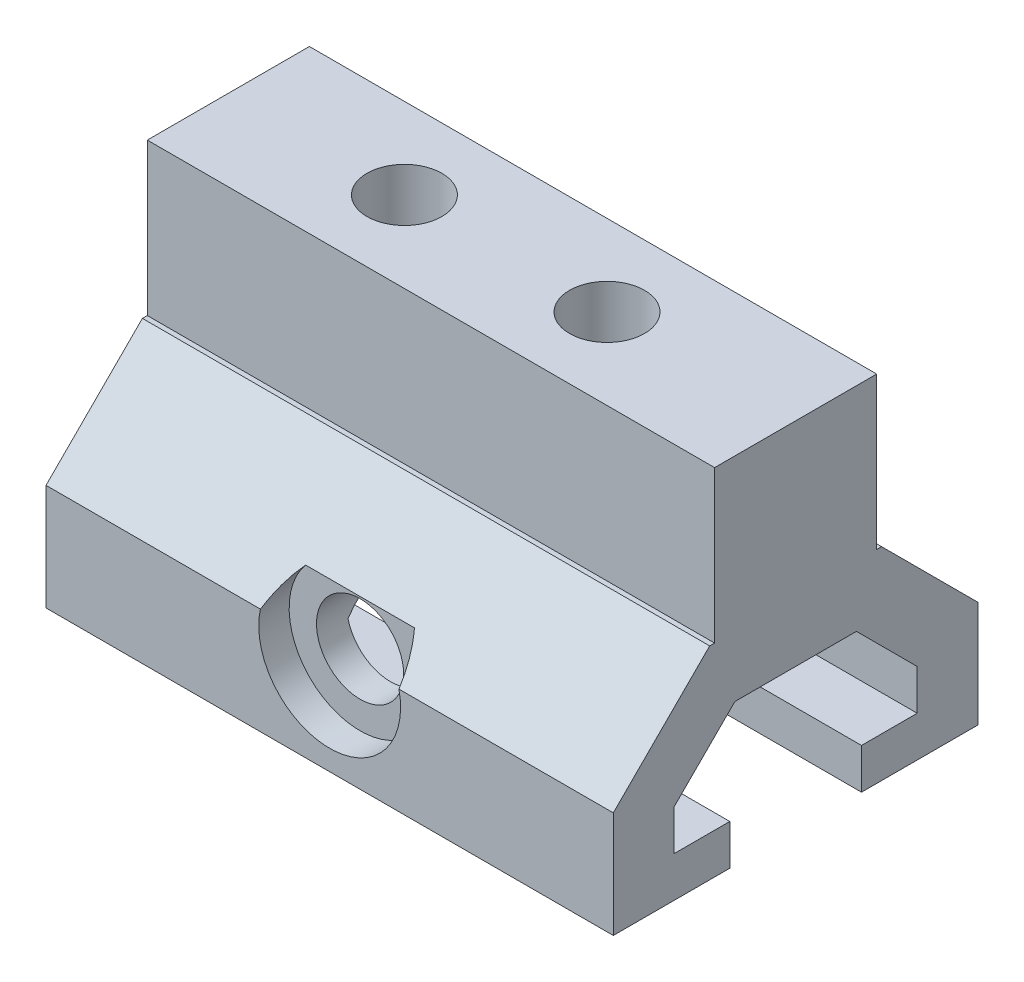
from build123d import *
from build123d.topology import SkipClean

# Parameters (mm, degrees)
CROQUIS1_W              = 28
CROQUIS1_H              = 8
CROQUIS1_R              = 1.85
SALIENTE_EXTRUIR1_DEPTH = 7.5
SALIENTE_EXTRUIR2_DEPTH = 28
CROQUIS4_R              = 1.85
CORTAR_EXTRUIR1_DEPTH   = 20.416487839
CROQUIS5_R              = 3
CORTAR_EXTRUIR2_DEPTH   = 3.5
CORTAR_EXTRUIR3_DEPTH   = 25.899799196
CROQUIS7_R              = 3.5
CORTAR_EXTRUIR4_DEPTH   = 1.5
CROQUIS8_R              = 2.15
CORTAR_EXTRUIR5_DEPTH   = 5


with BuildPart() as part:
    # Croquis1 → Saliente-Extruir1 (new body)
    with BuildSketch(Plane(origin=(0, 0, 0), x_dir=(1, 0, 0), z_dir=(0, 1, 0))):
        Rectangle(CROQUIS1_W, CROQUIS1_H)
        with Locations(Location((-5.31, 0, 0), (0, 0, 270))):
            Circle(CROQUIS1_R, mode=Mode.SUBTRACT)
        with Locations(Location((4.69, 0, 0), (0, 0, 270))):
            Circle(CROQUIS1_R, mode=Mode.SUBTRACT)
    extrude(amount=SALIENTE_EXTRUIR1_DEPTH)

    # Croquis3 → Saliente-Extruir2 (add, through all)
    with BuildSketch(Plane.ZY.offset(14)):
        Polygon((-4.242640687, 0), (4.242640687, 0), (9, -4.757359313), (9, -10), (3.25, -10), (3.25, -8), (6, -8), (6, -6), (3, -3), (-3, -3), (-6, -6), (-6, -8), (-3.25, -8), (-3.25, -10), (-9, -10), (-9, -4.757359313), align=None)
    extrude(amount=-SALIENTE_EXTRUIR2_DEPTH)

    # Croquis4 → Cortar-Extruir1 (cut, through all)
    with SkipClean():  # the faces are left unmerged after this step: merging them gives an invalid solid
        with BuildSketch(Plane(origin=(0, 0, 0), x_dir=(1, 0, 0), z_dir=(0, 1, 0))):
            with Locations(Location((4.69, 0, 0), (0, 0, 90))):
                Circle(CROQUIS4_R)
            with Locations(Location((-5.31, 0, 0), (0, 0, 90))):
                Circle(CROQUIS4_R)
        extrude(amount=-CORTAR_EXTRUIR1_DEPTH, mode=Mode.SUBTRACT)

    # Croquis5 → Cortar-Extruir2 (cut)
    with BuildSketch(Plane.XZ.offset(3)):
        with Locations(Location((-5.31, 0, 0), (0, 0, 270))):
            Circle(CROQUIS5_R)
        with Locations(Location((4.69, 0, 0), (0, 0, 270))):
            Circle(CROQUIS5_R)
    extrude(amount=-CORTAR_EXTRUIR2_DEPTH, mode=Mode.SUBTRACT)

    # Croquis6 → Cortar-Extruir3 (cut, through all)
    with BuildSketch(Plane.XY.offset(9)):
        with BuildLine():
            ThreePointArc((-1.748852427, -4.757359313), (-0.378932969, -7.361829693), (1.9, -5.5))
            ThreePointArc((1.9, -5.5), (1.861829693, -5.121067031), (1.748852427, -4.757359313))
            Line((1.748852427, -4.757359313), (-1.748852427, -4.757359313))
        make_face()
        with BuildLine():
            Line((-1.748852427, -4.757359313), (1.748852427, -4.757359313))
            ThreePointArc((1.748852427, -4.757359313), (0, -3.6), (-1.748852427, -4.757359313))
        make_face()
    extrude(amount=-CORTAR_EXTRUIR3_DEPTH, mode=Mode.SUBTRACT)

    # Croquis7 → Cortar-Extruir4 (cut)
    with BuildSketch(Plane.XY.offset(9)):
        with Locations((0, -5.5)):
            Circle(CROQUIS7_R)
    extrude(amount=-CORTAR_EXTRUIR4_DEPTH, mode=Mode.SUBTRACT)

    # Croquis8 → Cortar-Extruir5 (cut)
    with BuildSketch(Plane.XY.offset(7.5)):
        with Locations((0, -5.5)):
            Circle(CROQUIS8_R)
    extrude(amount=-CORTAR_EXTRUIR5_DEPTH, mode=Mode.SUBTRACT)


solid = part.part
